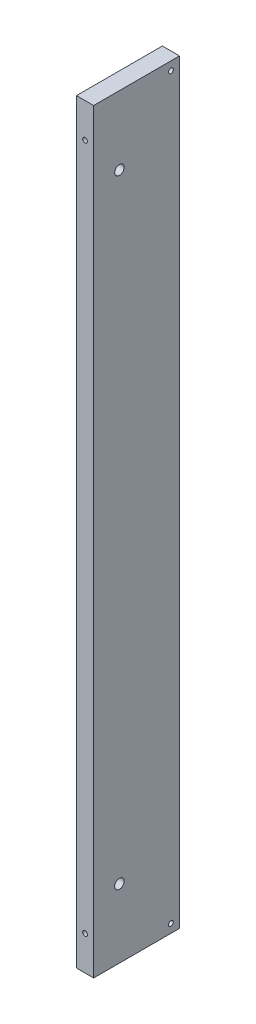
from build123d import *

# Parameters (mm, degrees)
SKETCH3_W           = 10
SKETCH3_H           = 440
BOSS_EXTRUDE1_DEPTH = 50
SKETCH4_R           = 1.4
CUT_EXTRUDE2_DEPTH  = 10
SKETCH5_R           = 2.75
CUT_EXTRUDE3_DEPTH  = 10
SKETCH6_R           = 1.4
CUT_EXTRUDE4_DEPTH  = 10


with BuildPart() as part:
    # Sketch3 → Boss-Extrude1 (new body)
    with BuildSketch(Plane.XY):
        with Locations((5, 220)):
            Rectangle(SKETCH3_W, SKETCH3_H)
    extrude(amount=BOSS_EXTRUDE1_DEPTH)

    # Sketch4 → Cut-Extrude2 (cut)
    with BuildSketch(Plane.XY.offset(50)):
        with Locations((5, 420)):
            Circle(SKETCH4_R)
        with Locations((5, 20)):
            Circle(SKETCH4_R)
    extrude(amount=-CUT_EXTRUDE2_DEPTH, mode=Mode.SUBTRACT)

    # Sketch5 → Cut-Extrude3 (cut)
    with BuildSketch(Plane.ZY):
        with Locations((35, 400)):
            Circle(SKETCH5_R)
        with Locations((35, 40)):
            Circle(SKETCH5_R)
    extrude(amount=-CUT_EXTRUDE3_DEPTH, mode=Mode.SUBTRACT)

    # Sketch6 → Cut-Extrude4 (cut)
    with BuildSketch(Plane.ZY):
        with Locations((5, 435)):
            Circle(SKETCH6_R)
        with Locations((5, 5)):
            Circle(SKETCH6_R)
    extrude(amount=-CUT_EXTRUDE4_DEPTH, mode=Mode.SUBTRACT)


solid = part.part
